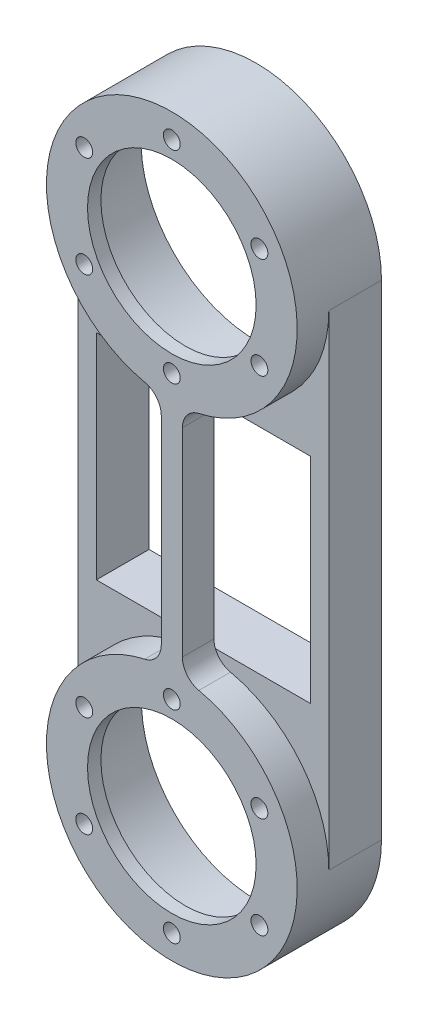
from build123d import *
from build123d.topology import SkipClean

# Parameters (mm, degrees)
SKETCH1_R           = 27.5
BOSS_EXTRUDE1_DEPTH = 20
BOSS_EXTRUDE2_START = -3.175
SKETCH2_R           = 20
SKETCH2_R_2         = 2
BOSS_EXTRUDE2_DEPTH = 3.175
CUT_EXTRUDE6_DEPTH  = 44
FILLET4_R           = 5
SKETCH9_R           = 27.302550199
SKETCH9_R_2         = 27.201682831
BOSS_EXTRUDE3_DEPTH = 12.5
SKETCH12_W          = 50.8
SKETCH12_H          = 50.8
CUT_EXTRUDE7_DEPTH  = 12.5


with BuildPart() as part:
    # Sketch1 → Boss-Extrude1 (new body)
    with BuildSketch(Plane.XY):
        with BuildLine():
            Line((-29.75, 57.5), (-29.75, -57.5))
            ThreePointArc((-29.75, -57.5), (0, -87.25), (29.75, -57.5))
            Line((29.75, -57.5), (29.75, 57.5))
            ThreePointArc((29.75, 57.5), (0, 87.25), (-29.75, 57.5))
        make_face()
        with Locations((0, 57.5)):
            Circle(SKETCH1_R, mode=Mode.SUBTRACT)
        with Locations(Location((0, -57.5, 0), (0, 0, 180))):
            Circle(SKETCH1_R, mode=Mode.SUBTRACT)
    extrude(amount=BOSS_EXTRUDE1_DEPTH)

    # Sketch2 → Boss-Extrude2 (add)
    with BuildSketch(Plane.XY.offset(20).offset(BOSS_EXTRUDE2_START)):
        with BuildLine():
            Line((-29.75, 57.5), (-29.75, -57.5))
            ThreePointArc((-29.75, -57.5), (0, -87.25), (29.75, -57.5))
            Line((29.75, -57.5), (29.75, 57.5))
            ThreePointArc((29.75, 57.5), (0, 87.25), (-29.75, 57.5))
        make_face()
        with Locations((0, 57.5)):
            Circle(SKETCH2_R, mode=Mode.SUBTRACT)
        with Locations((0, 81.5)):
            Circle(SKETCH2_R_2, mode=Mode.SUBTRACT)
        with Locations((20.784609691, 69.5)):
            Circle(SKETCH2_R_2, mode=Mode.SUBTRACT)
        with Locations((20.784609691, 45.5)):
            Circle(SKETCH2_R_2, mode=Mode.SUBTRACT)
        with Locations((0, 33.5)):
            Circle(SKETCH2_R_2, mode=Mode.SUBTRACT)
        with Locations((-20.784609691, 45.5)):
            Circle(SKETCH2_R_2, mode=Mode.SUBTRACT)
        with Locations((-20.784609691, 69.5)):
            Circle(SKETCH2_R_2, mode=Mode.SUBTRACT)
        with Locations(Location((-20.784609691, -69.5, 0), (0, 0, 180))):
            Circle(SKETCH2_R_2, mode=Mode.SUBTRACT)
        with Locations(Location((-20.784609691, -45.5, 0), (0, 0, 180))):
            Circle(SKETCH2_R_2, mode=Mode.SUBTRACT)
        with Locations(Location((0, -33.5, 0), (0, 0, 180))):
            Circle(SKETCH2_R_2, mode=Mode.SUBTRACT)
        with Locations(Location((20.784609691, -45.5, 0), (0, 0, 180))):
            Circle(SKETCH2_R_2, mode=Mode.SUBTRACT)
        with Locations(Location((20.784609691, -69.5, 0), (0, 0, 180))):
            Circle(SKETCH2_R_2, mode=Mode.SUBTRACT)
        with Locations(Location((0, -81.5, 0), (0, 0, 180))):
            Circle(SKETCH2_R_2, mode=Mode.SUBTRACT)
        with Locations(Location((0, -57.5, 0), (0, 0, 180))):
            Circle(SKETCH2_R, mode=Mode.SUBTRACT)
    extrude(amount=BOSS_EXTRUDE2_DEPTH)

    # Sketch8 → Cut-Extrude6 (cut)
    with SkipClean():  # the faces are left unmerged after this step: merging them gives an invalid solid
        with BuildSketch(Plane(origin=(0, 0, 0), x_dir=(-1, 0, 0), z_dir=(0, 0, -1))):
            with BuildLine():
                Line((-2.5, -27.855228117), (-2.5, 27.855228117))
                ThreePointArc((-2.5, 27.855228117), (-21.902482736, 37.366849477), (-29.75, 57.5))
                Line((-29.75, 57.5), (-29.75, -57.5))
                ThreePointArc((-29.75, -57.5), (-21.902482736, -37.366849477), (-2.5, -27.855228117))
            make_face()
            with BuildLine():
                Line((2.5, -27.855228117), (2.5, 27.855228117))
                ThreePointArc((2.5, 27.855228117), (21.902482736, 37.366849477), (29.75, 57.5))
                Line((29.75, 57.5), (29.75, -57.5))
                ThreePointArc((29.75, -57.5), (21.902482736, -37.366849477), (2.5, -27.855228117))
            make_face()
        extrude(amount=-CUT_EXTRUDE6_DEPTH, mode=Mode.SUBTRACT)

    # Fillet4
    fillet4_edges = [part.edges().sort_by_distance(p)[0] for p in [
        (2.5, -27.855228117, 10),
        (2.5, 27.855228117, 10),
        (-2.5, 27.855228117, 10),
        (-2.5, -27.855228117, 10),
    ]]
    fillet(fillet4_edges, radius=FILLET4_R)

    # Sketch9 → Boss-Extrude3 (add)
    with BuildSketch(Plane.XY):
        with BuildLine():
            Line((-29.75, 57.5), (-29.75, -57.5))
            ThreePointArc((-29.75, -57.5), (0, -87.25), (29.75, -57.5))
            Line((29.75, -57.5), (29.75, 57.5))
            ThreePointArc((29.75, 57.5), (0, 87.25), (-29.75, 57.5))
        make_face()
        with Locations((0, 57.5)):
            Circle(SKETCH9_R, mode=Mode.SUBTRACT)
        with Locations((0, -57.5)):
            Circle(SKETCH9_R_2, mode=Mode.SUBTRACT)
    extrude(amount=BOSS_EXTRUDE3_DEPTH)

    # Sketch12 → Cut-Extrude7 (cut)
    with BuildSketch(Plane(origin=(0, 0, 0), x_dir=(-1, 0, 0), z_dir=(0, 0, -1))):
        Rectangle(SKETCH12_W, SKETCH12_H)
    extrude(amount=-CUT_EXTRUDE7_DEPTH, mode=Mode.SUBTRACT)


solid = part.part
